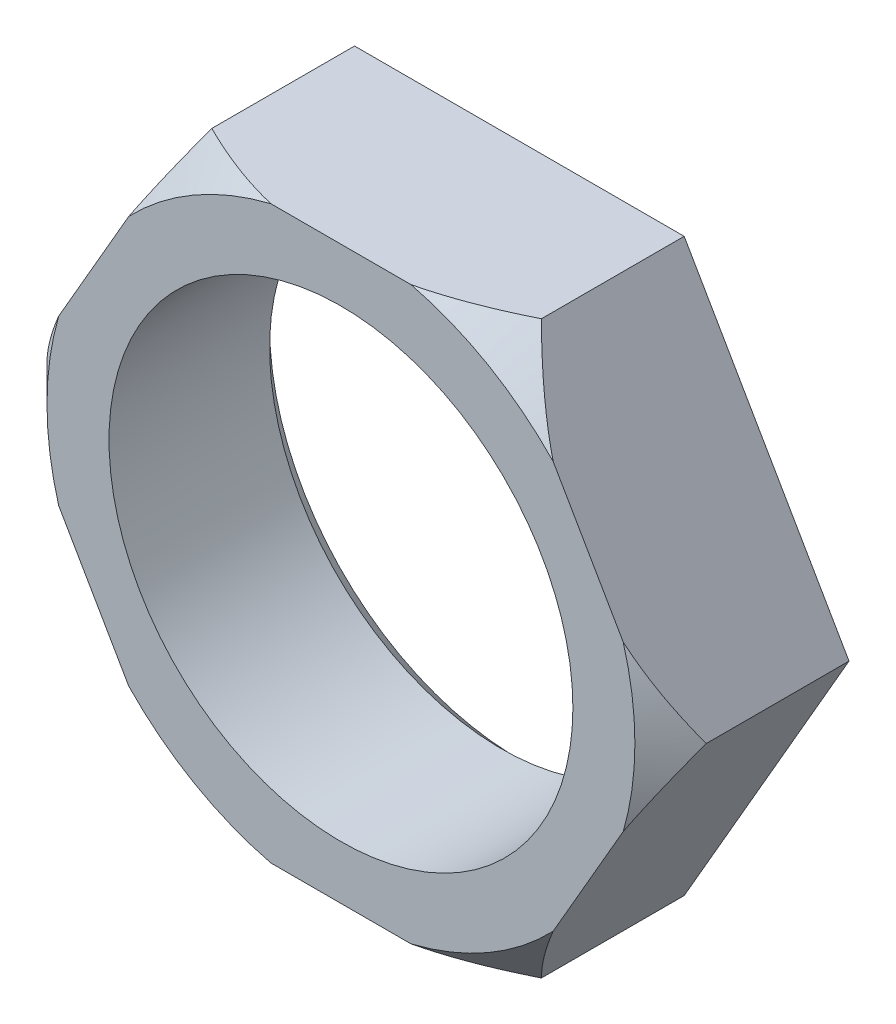
from build123d import *

# Parameters (mm, degrees)
SZKIC1_R                    = 6.5
DODANIE_WYCI_GNI_CIE3_DEPTH = 5
SFAZOWANIE3_SIZE            = 0.5


with BuildPart() as part:
    # Szkic1 → Dodanie-wyciągnięcie3 (new body)
    with BuildSketch(Plane.XY):
        Polygon((9.237604307, 0), (4.618802154, 8), (-4.618802154, 8), (-9.237604307, 0), (-4.618802154, -8), (4.618802154, -8), align=None)
        Circle(SZKIC1_R, mode=Mode.SUBTRACT)
    extrude(amount=DODANIE_WYCI_GNI_CIE3_DEPTH)

    # Szkic2 → Wycięcie-obrót3 (revolve, cut)
    with BuildSketch(Plane(origin=(0, 0, 0), x_dir=(1, 0, 0), z_dir=(0, 1, 0))):
        Polygon((9.237604307, -5), (9.237604307, -4), (8.237604307, -5), align=None)
    revolve(axis=Axis((0, 0, 0), (0, 0, 1)), mode=Mode.SUBTRACT)

    # Sfazowanie3
    sfazowanie3_edges = [part.edges().sort_by_distance(p)[0] for p in [
        (-6.5, 0, 0),
    ]]
    chamfer(sfazowanie3_edges, length=SFAZOWANIE3_SIZE)


solid = part.part
